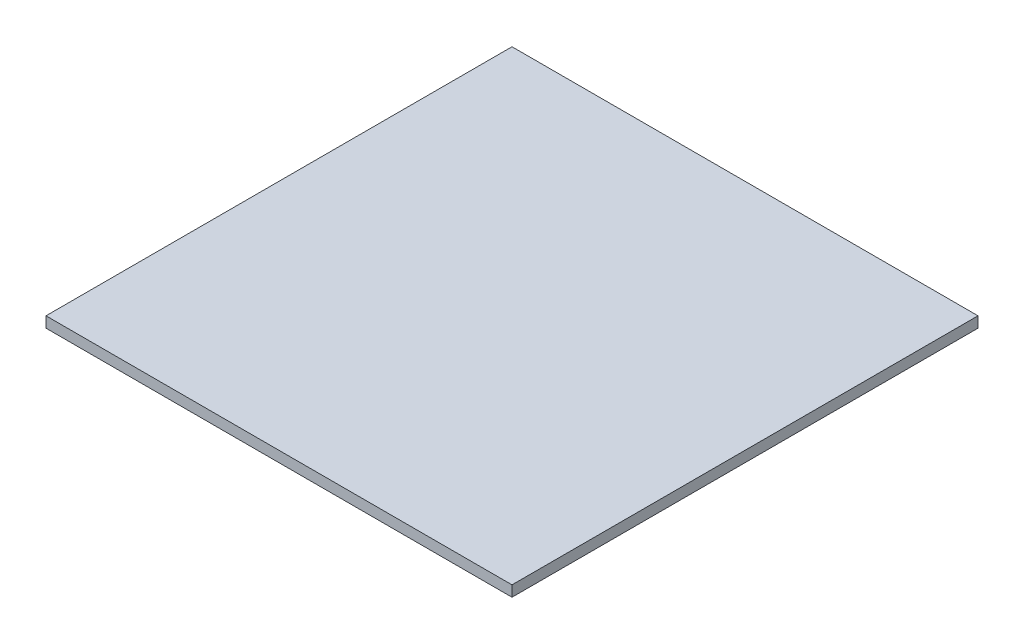
from build123d import *

# Parameters (mm, degrees)
SKETCH1_W           = 260
SKETCH1_H           = 260
BOSS_EXTRUDE1_DEPTH = 6


with BuildPart() as part:
    # Sketch1 → Boss-Extrude1 (new body)
    with BuildSketch(Plane(origin=(0, 0, 0), x_dir=(1, 0, 0), z_dir=(0, 1, 0))):
        Rectangle(SKETCH1_W, SKETCH1_H)
    extrude(amount=BOSS_EXTRUDE1_DEPTH)


solid = part.part
